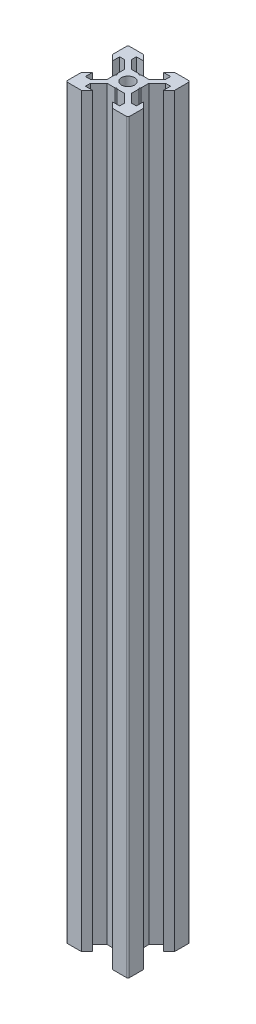
from build123d import *

# Parameters (mm, degrees)
SKETCH_28_R               = 2.075
EXTRUDE_2020V_DEPTH       = 240
HOLE_WIZARD_1_2020V_D     = 4.2
HOLE_WIZARD_1_2020V_DEPTH = 12.4
HOLE_WIZARD_1_2020V_TIP   = 1.2618073
HOLE_WIZARD_2_2020V_D     = 4.2
HOLE_WIZARD_2_2020V_DEPTH = 12.4
HOLE_WIZARD_2_2020V_TIP   = 1.2618073


with BuildPart() as part:
    # 草图28 → 2020V (new body)
    with BuildSketch(Plane(origin=(0, 0, 0), x_dir=(1, 0, 0), z_dir=(0, 1, 0))):
        with BuildLine():
            Line((-3.900000395, 2.839340223), (-3.900000395, 0.282843107))
            Line((-3.900000395, 0.282843107), (-3.617157288, 0))
            Line((-3.617157288, 0), (-3.9, -0.282842712))
            Line((-3.9, -0.282842712), (-3.9, -2.839339828))
            Line((-3.9, -2.839339828), (-6.560660172, -5.5))
            Line((-6.560660172, -5.5), (-8.2, -5.5))
            Line((-8.2, -5.5), (-8.2, -3.150000255))
            Line((-8.2, -3.150000255), (-10, -4.950000255))
            Line((-10, -4.950000255), (-10, -9.5))
            ThreePointArc((-10, -9.5), (-9.853553391, -9.853553391), (-9.5, -10))
            Line((-9.5, -10), (-4.950000255, -10))
            Line((-4.950000255, -10), (-3.150000255, -8.2))
            Line((-3.150000255, -8.2), (-5.5, -8.2))
            Line((-5.5, -8.2), (-5.5, -6.560660172))
            Line((-5.5, -6.560660172), (-2.839339828, -3.9))
            Line((-2.839339828, -3.9), (-0.282842712, -3.9))
            Line((-0.282842712, -3.9), (0, -3.617157288))
            Line((0, -3.617157288), (0.282842712, -3.9))
            Line((0.282842712, -3.9), (2.839339828, -3.9))
            Line((2.839339828, -3.9), (5.5, -6.560660172))
            Line((5.5, -6.560660172), (5.5, -8.2))
            Line((5.5, -8.2), (3.150000255, -8.2))
            Line((3.150000255, -8.2), (4.950000255, -10))
            Line((4.950000255, -10), (9.5, -10))
            ThreePointArc((9.5, -10), (9.853553391, -9.853553391), (10, -9.5))
            Line((10, -9.5), (10, -4.950000255))
            Line((10, -4.950000255), (8.2, -3.150000255))
            Line((8.2, -3.150000255), (8.2, -5.5))
            Line((8.2, -5.5), (6.560660172, -5.5))
            Line((6.560660172, -5.5), (3.9, -2.839339828))
            Line((3.9, -2.839339828), (3.9, -0.282842712))
            Line((3.9, -0.282842712), (3.617157288, 0))
            Line((3.617157288, 0), (3.900000116, 0.282842829))
            Line((3.900000116, 0.282842829), (3.900000116, 2.839339944))
            Line((3.900000116, 2.839339944), (6.560660288, 5.500000116))
            Line((6.560660288, 5.500000116), (8.200000116, 5.500000116))
            Line((8.200000116, 5.500000116), (8.200000116, 3.150000371))
            Line((8.200000116, 3.150000371), (10.000000116, 4.950000371))
            Line((10.000000116, 4.950000371), (10.000000116, 9.499999884))
            ThreePointArc((10.000000116, 9.499999884), (9.853553507, 9.853553275), (9.500000116, 9.999999884))
            Line((9.500000116, 9.999999884), (4.950000139, 9.999999884))
            Line((4.950000139, 9.999999884), (3.150000139, 8.199999884))
            Line((3.150000139, 8.199999884), (5.499999884, 8.199999884))
            Line((5.499999884, 8.199999884), (5.499999884, 6.560660056))
            Line((5.499999884, 6.560660056), (2.839339712, 3.899999884))
            Line((2.839339712, 3.899999884), (0.282842991, 3.899999884))
            Line((0.282842991, 3.899999884), (0, 3.617156893))
            Line((0, 3.617156893), (-0.282842712, 3.899999605))
            Line((-0.282842712, 3.899999605), (-2.839339434, 3.899999605))
            Line((-2.839339434, 3.899999605), (-5.499999605, 6.560659777))
            Line((-5.499999605, 6.560659777), (-5.499999605, 8.199999605))
            Line((-5.499999605, 8.199999605), (-3.149999861, 8.199999605))
            Line((-3.149999861, 8.199999605), (-4.949999861, 9.999999605))
            Line((-4.949999861, 9.999999605), (-9.500000395, 9.999999605))
            ThreePointArc((-9.500000395, 9.999999605), (-9.853553785, 9.853552996), (-10.000000395, 9.499999605))
            Line((-10.000000395, 9.499999605), (-10.000000395, 4.95000065))
            Line((-10.000000395, 4.95000065), (-8.200000395, 3.15000065))
            Line((-8.200000395, 3.15000065), (-8.200000395, 5.500000395))
            Line((-8.200000395, 5.500000395), (-6.560660566, 5.500000395))
            Line((-6.560660566, 5.500000395), (-3.900000395, 2.839340223))
        make_face()
        with Locations(Location((0, 0, 0), (0, 0, 270))):
            Circle(SKETCH_28_R, mode=Mode.SUBTRACT)
    extrude(amount=EXTRUDE_2020V_DEPTH)

    # 1-2020V
    with Locations(Plane(origin=(0, 240, 0), x_dir=(1, 0, 0), z_dir=(0, 1, 0))):
        with Locations((0, 0)):
            Hole(HOLE_WIZARD_1_2020V_D / 2, depth=HOLE_WIZARD_1_2020V_DEPTH)
            with Locations((0, 0, -(HOLE_WIZARD_1_2020V_DEPTH + HOLE_WIZARD_1_2020V_TIP / 2))):  # 118° drill point
                Cone(0, HOLE_WIZARD_1_2020V_D / 2, HOLE_WIZARD_1_2020V_TIP, mode=Mode.SUBTRACT)

    # 2-2020V
    with Locations(Plane(origin=(0, 0, 0), x_dir=(-1, 0, 0), z_dir=(0, -1, 0))):
        with Locations((0, 0)):
            Hole(HOLE_WIZARD_2_2020V_D / 2, depth=HOLE_WIZARD_2_2020V_DEPTH)
            with Locations((0, 0, -(HOLE_WIZARD_2_2020V_DEPTH + HOLE_WIZARD_2_2020V_TIP / 2))):  # 118° drill point
                Cone(0, HOLE_WIZARD_2_2020V_D / 2, HOLE_WIZARD_2_2020V_TIP, mode=Mode.SUBTRACT)


solid = part.part
